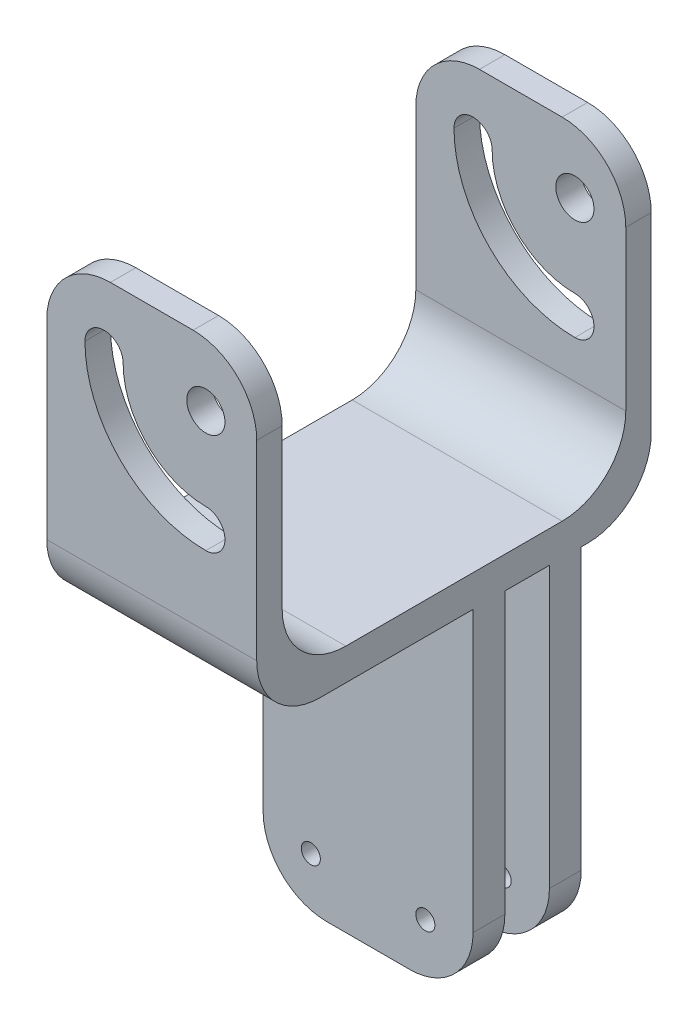
from build123d import *

# Parameters (mm, degrees)
ESBO_O1_W                = 33
ESBO_O1_H                = 50
ESBO_O1_R                = 3
RESSALTO_EXTRUS_O2_DEPTH = 62
ESBO_O3_W                = 33
ESBO_O3_H                = 54
CORTE_EXTRUS_O1_DEPTH    = 45
ESBO_O7_W                = 33
ESBO_O7_H                = 5
RESSALTO_EXTRUS_O3_DEPTH = 54
ESBO_O10_R               = 1.5
CORTE_EXTRUS_O2_DEPTH    = 82.277303105
FILETE1_R                = 10


with BuildPart() as part:
    # Esboço1 → Ressalto-extrusão2 (new body)
    with BuildSketch(Plane.XY):
        with Locations((16.5, 25)):
            Rectangle(ESBO_O1_W, ESBO_O1_H)
        with Locations((25, 40)):
            Circle(ESBO_O1_R, mode=Mode.SUBTRACT)
        with BuildLine():
            ThreePointArc((6, 40), (11.564971157, 26.564971157), (25, 21))
            ThreePointArc((25, 21), (28, 24), (25, 27))
            ThreePointArc((25, 27), (15.807611845, 30.807611845), (12, 40))
            ThreePointArc((12, 40), (9, 43), (6, 40))
        make_face(mode=Mode.SUBTRACT)
    extrude(amount=RESSALTO_EXTRUS_O2_DEPTH)

    # Esboço3 → Corte-extrusão1 (cut)
    with BuildSketch(Plane(origin=(0, 50, 0), x_dir=(1, 0, 0), z_dir=(0, 1, 0))):
        with Locations((16.5, -31)):
            Rectangle(ESBO_O3_W, ESBO_O3_H)
    extrude(amount=-CORTE_EXTRUS_O1_DEPTH, mode=Mode.SUBTRACT)

    # Esboço7 → Ressalto-extrusão3 (add)
    with BuildSketch(Plane.XZ):
        with Locations((16.5, 25.5)):
            Rectangle(ESBO_O7_W, ESBO_O7_H)
        with Locations((16.5, 13.5)):
            Rectangle(ESBO_O7_W, ESBO_O7_H)
    extrude(amount=RESSALTO_EXTRUS_O3_DEPTH)

    # Esboço10 → Corte-extrusão2 (cut, through all)
    with BuildSketch(Plane(origin=(0, 0, 11), x_dir=(-1, 0, 0), z_dir=(0, 0, -1))):
        with Locations((-25.5, -46)):
            Circle(ESBO_O10_R)
        with Locations((-7.5, -46)):
            Circle(ESBO_O10_R)
    extrude(amount=-CORTE_EXTRUS_O2_DEPTH, mode=Mode.SUBTRACT)

    # Filete1
    filete1_edges = [part.edges().sort_by_distance(p)[0] for p in [
        (0, 50, 2),
        (33, 50, 2),
        (16.5, 5, 4),
        (16.5, 5, 58),
        (16.5, 0, 62),
        (16.5, 0, 0),
        (33, -54, 25.5),
        (0, -54, 25.5),
        (33, -54, 13.5),
        (0, -54, 13.5),
        (0, 50, 60),
        (33, 50, 60),
    ]]
    fillet(filete1_edges, radius=FILETE1_R)


solid = part.part
